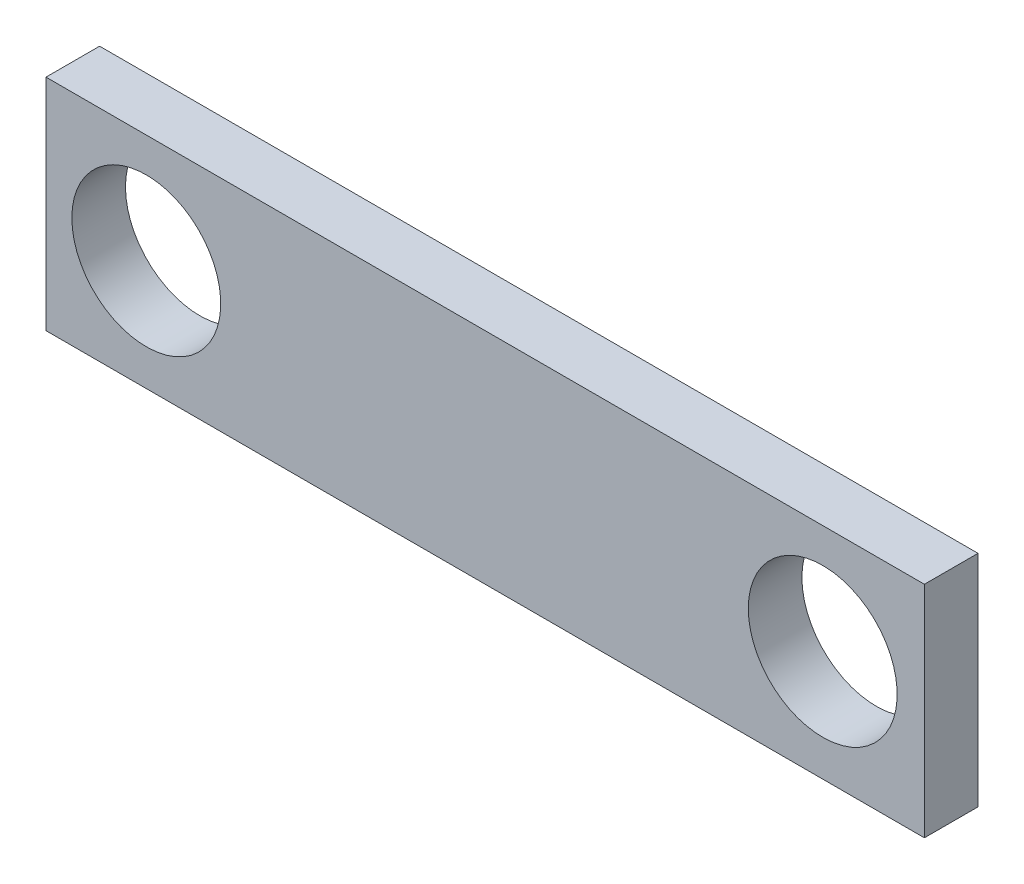
from build123d import *

# Parameters (mm, degrees)
ESQUISSE2_W        = 25.4
ESQUISSE2_H        = 6.35
BOSS_EXTRU_1_DEPTH = 1.55
D_GAGEMENT_61_D    = 4.3053


with BuildPart() as part:
    # Esquisse2 → Boss.-Extru.1 (new body)
    with BuildSketch(Plane.XY.offset(3)):
        with Locations((13.938249305, -56.974105441)):
            Rectangle(ESQUISSE2_W, ESQUISSE2_H)
    extrude(amount=BOSS_EXTRU_1_DEPTH)

    # Dégagement #61 (through all)
    with Locations(Plane(origin=(0, 0, 3), x_dir=(-1, 0, 0), z_dir=(0, 0, -1))):
        with Locations((-4.138249305, -56.949105441), (-23.698249305, -56.949105441)):
            Hole(D_GAGEMENT_61_D / 2)


solid = part.part
